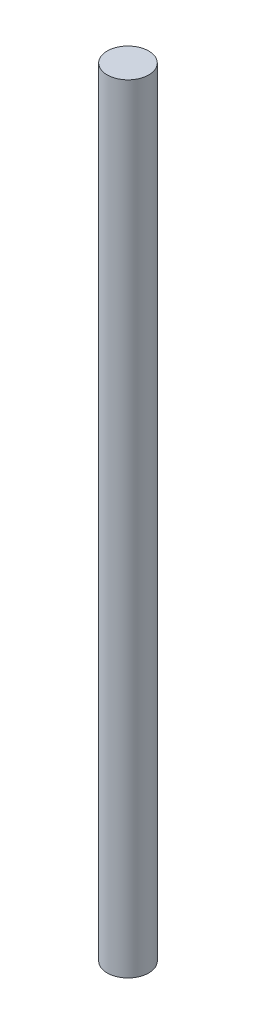
from build123d import *

# Parameters (mm, degrees)
CROQUIS1_R              = 4
SALIENTE_EXTRUIR1_DEPTH = 75


with BuildPart() as part:
    # Croquis1 → Saliente-Extruir1 (new, symmetric)
    with BuildSketch(Plane(origin=(0, 0, 0), x_dir=(1, 0, 0), z_dir=(0, 1, 0))):
        with Locations(Location((0, 0, 0), (0, 0, 270))):
            Circle(CROQUIS1_R)
    extrude(amount=SALIENTE_EXTRUIR1_DEPTH, both=True)


solid = part.part
